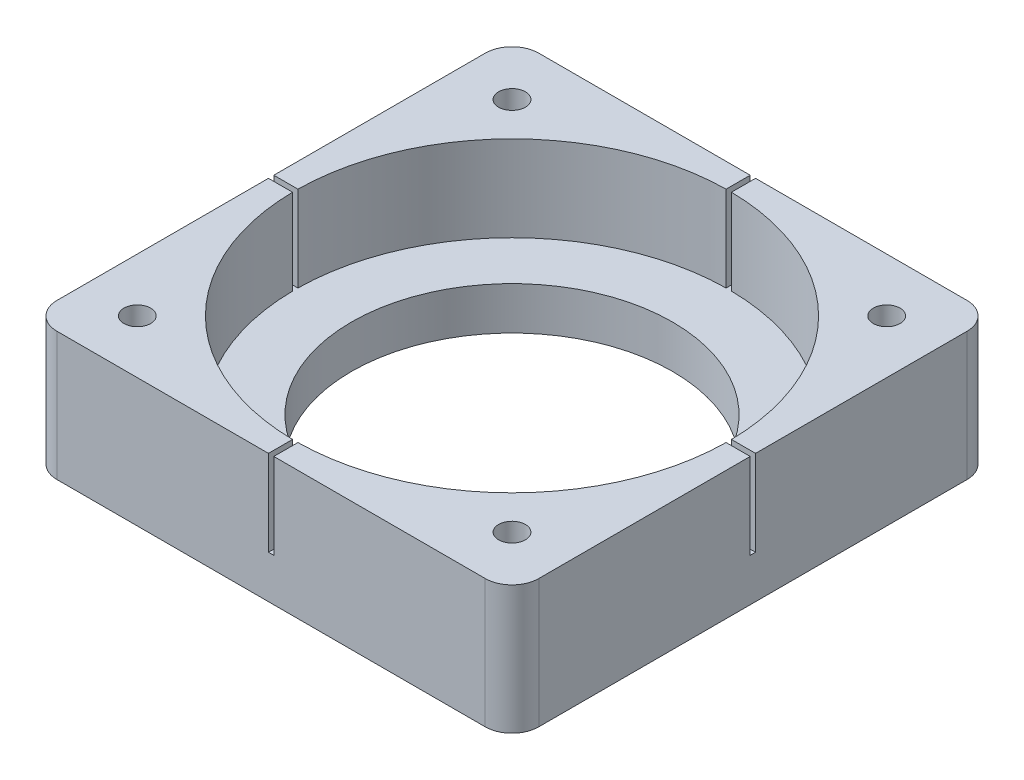
from build123d import *

# Parameters (mm, degrees)
SKETCH1_W             = 90
SKETCH1_H             = 90
SKETCH1_R             = 34
BOSS_EXTRUDE1_DEPTH   = 24
SKETCH2_R             = 40.5
CUT_EXTRUDE1_DEPTH    = 16
SKETCH3_R             = 12.7
CUT_EXTRUDE2_DEPTH    = 19
M6X1_0_TAPPED_HOLE1_D = 5
FILLET1_R             = 5
SKETCH7_R             = 30
SKETCH7_R_2           = 20
SKETCH7_R_3           = 12.7
CUT_EXTRUDE3_DEPTH    = 66.620118866
SKETCH8_W             = 13.825432395
SKETCH8_H             = 1
SKETCH8_W_2           = 1
SKETCH8_H_2           = 13.825432395
CUT_EXTRUDE4_DEPTH    = 16


with BuildPart() as part:
    # Sketch1 → Boss-Extrude1 (new body)
    # profile 1 of 2: a face of its own
    with BuildSketch(Plane(origin=(0, 0, 0), x_dir=(1, 0, 0), z_dir=(0, 1, 0))):
        Rectangle(SKETCH1_W, SKETCH1_H)
        Circle(SKETCH1_R, mode=Mode.SUBTRACT)
    # profile 2 of 2: a face of its own
    with BuildSketch(Plane(origin=(0, 0, 0), x_dir=(1, 0, 0), z_dir=(0, 1, 0))):
        Circle(SKETCH1_R)
    extrude(amount=BOSS_EXTRUDE1_DEPTH)

    # Sketch2 → Cut-Extrude1 (cut)
    with BuildSketch(Plane(origin=(0, 24, 0), x_dir=(1, 0, 0), z_dir=(0, 1, 0))):
        with Locations(Location((0, 0, 0), (0, 0, 270))):
            Circle(SKETCH2_R)
    extrude(amount=-CUT_EXTRUDE1_DEPTH, mode=Mode.SUBTRACT)

    # Sketch3 → Cut-Extrude2 (cut)
    with BuildSketch(Plane(origin=(0, 8, 0), x_dir=(1, 0, 0), z_dir=(0, 1, 0))):
        with Locations(Location((0, 0, 0), (0, 0, 270))):
            Circle(SKETCH3_R)
    extrude(amount=-CUT_EXTRUDE2_DEPTH, mode=Mode.SUBTRACT)

    # M6x1.0 Tapped Hole1 (through all)
    with Locations(Plane(origin=(0, 0, 0), x_dir=(-1, 0, 0), z_dir=(0, -1, 0))):
        with Locations((35, 35), (35, -35), (-35, -35), (-35, 35)):
            Hole(M6X1_0_TAPPED_HOLE1_D / 2)

    # Fillet1
    fillet1_edges = [part.edges().sort_by_distance(p)[0] for p in [
        (-45, 12, 45),
        (-45, 12, -45),
        (45, 12, -45),
        (45, 12, 45),
    ]]
    fillet(fillet1_edges, radius=FILLET1_R)

    # Sketch7 → Cut-Extrude3 (cut, through all)
    # profile 1 of 2: a face of its own
    with BuildSketch(Plane(origin=(0, 8, 0), x_dir=(1, 0, 0), z_dir=(0, 1, 0))):
        with Locations(Location((0, 0, 0), (0, 0, 270))):
            Circle(SKETCH7_R)
        Circle(SKETCH7_R_2, mode=Mode.SUBTRACT)
    # profile 2 of 2: a face of its own
    with BuildSketch(Plane(origin=(0, 8, 0), x_dir=(1, 0, 0), z_dir=(0, 1, 0))):
        Circle(SKETCH7_R_2)
        Circle(SKETCH7_R_3, mode=Mode.SUBTRACT)
    extrude(amount=-CUT_EXTRUDE3_DEPTH, mode=Mode.SUBTRACT)

    # Sketch8 → Cut-Extrude4 (cut)
    with BuildSketch(Plane(origin=(0, 24, 0), x_dir=(1, 0, 0), z_dir=(0, 1, 0))):
        with Locations((42.446502967, 0)):
            Rectangle(SKETCH8_W, SKETCH8_H)
        with Locations((0, 42.446502967)):
            Rectangle(SKETCH8_W_2, SKETCH8_H_2)
        with Locations((0, -42.446502967)):
            Rectangle(SKETCH8_W_2, SKETCH8_H_2)
        with Locations((-42.446502967, 0)):
            Rectangle(SKETCH8_W, SKETCH8_H)
    extrude(amount=-CUT_EXTRUDE4_DEPTH, mode=Mode.SUBTRACT)


solid = part.part
